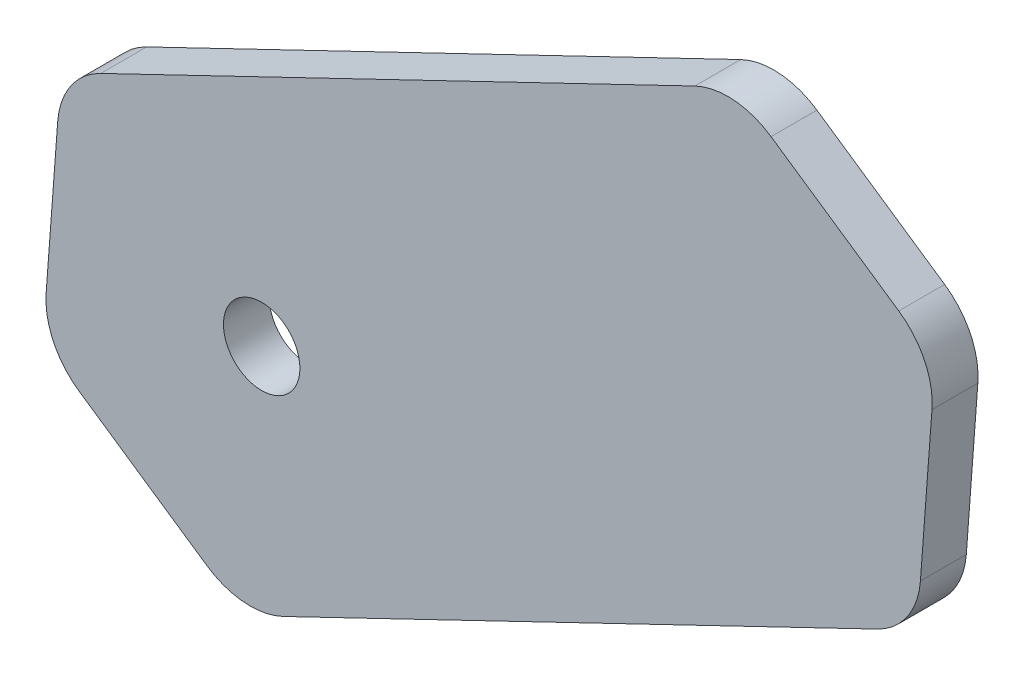
from build123d import *

# Parameters (mm, degrees)
SKETCH2_R           = 5
BOSS_EXTRUDE2_DEPTH = 6


with BuildPart() as part:
    # Sketch2 → Boss-Extrude2 (new body)
    with BuildSketch(Plane.XY):
        with BuildLine():
            Line((-174.697190786, 292.815340248), (-97.034286873, 330.217390401))
            ThreePointArc((-97.034286873, 330.217390401), (-91.948164306, 331.179822986), (-87.062236664, 329.470252771))
            Line((-87.062236664, 329.470252771), (-70.363764597, 318.085827856))
            ThreePointArc((-70.363764597, 318.085827856), (-66.987212246, 314.162332799), (-66.024779661, 309.076210233))
            Line((-66.024779661, 309.076210233), (-67.534744811, 288.922696761))
            ThreePointArc((-67.534744811, 288.922696761), (-69.244315026, 284.036769119), (-73.167810083, 280.660216768))
            Line((-73.167810083, 280.660216768), (-150.830713997, 243.258166615))
            ThreePointArc((-150.830713997, 243.258166615), (-155.916836563, 242.295734029), (-160.802764205, 244.005304245))
            Line((-160.802764205, 244.005304245), (-177.501236272, 255.389729159))
            ThreePointArc((-177.501236272, 255.389729159), (-180.877788623, 259.313224216), (-181.840221209, 264.399346783))
            Line((-181.840221209, 264.399346783), (-180.330256058, 284.552860254))
            ThreePointArc((-180.330256058, 284.552860254), (-178.620685843, 289.438787896), (-174.697190786, 292.815340248))
        make_face()
        with Locations((-153.660763686, 272.423436021)):
            Circle(SKETCH2_R, mode=Mode.SUBTRACT)
    extrude(amount=BOSS_EXTRUDE2_DEPTH)


solid = part.part
